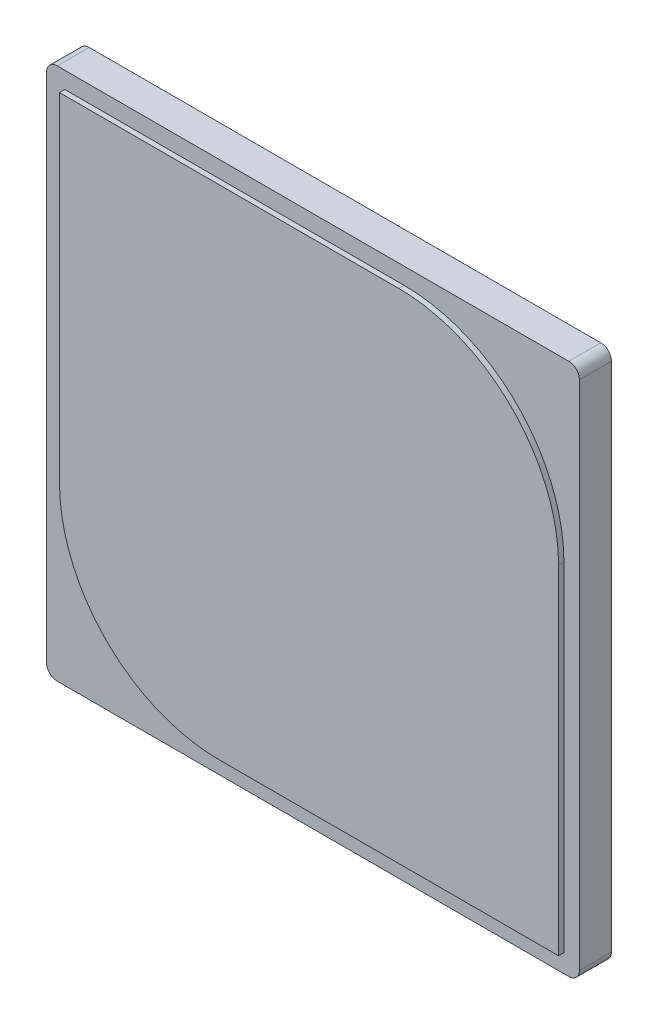
from build123d import *

# Parameters (mm, degrees)
SKETCH_1_W          = 10
SKETCH_1_H          = 10
EXTRUDE_1_DEPTH     = 0.7
SKETCH_2_W          = 10
SKETCH_2_H          = 10
CUT_EXTRUDE_1_DEPTH = 0.1
FILLET_1_R          = 0.2


with BuildPart() as part:
    # 草图1 → 凸台-拉伸1 (new body)
    with BuildSketch(Plane.XY):
        with Locations((-10.731707317, 12.731707317)):
            Rectangle(SKETCH_1_W, SKETCH_1_H)
    extrude(amount=EXTRUDE_1_DEPTH)

    # 草图2 → 切除-拉伸1 (cut)
    with BuildSketch(Plane.XY.offset(0.7)):
        with Locations((-10.731707317, 12.731707317)):
            Rectangle(SKETCH_2_W, SKETCH_2_H)
        with BuildLine():
            Line((-15.389589016, 17.419802303), (-9.02347014, 17.419802303))
            ThreePointArc((-9.02347014, 17.419802303), (-6.902149796, 16.541122647), (-6.02347014, 14.419802303))
            Line((-6.02347014, 14.419802303), (-6.02347014, 8.073825618))
            Line((-6.02347014, 8.073825618), (-12.389589016, 8.073825618))
            ThreePointArc((-12.389589016, 8.073825618), (-14.51090936, 8.952505274), (-15.389589016, 11.073825618))
            Line((-15.389589016, 11.073825618), (-15.389589016, 17.419802303))
        make_face(mode=Mode.SUBTRACT)
    extrude(amount=-CUT_EXTRUDE_1_DEPTH, mode=Mode.SUBTRACT)

    # 圆角1
    fillet_1_edges = [part.edges().sort_by_distance(p)[0] for p in [
        (-15.731707317, 17.731707317, 0.3),
        (-5.731707317, 17.731707317, 0.3),
        (-5.731707317, 7.731707317, 0.3),
        (-15.731707317, 7.731707317, 0.3),
    ]]
    fillet(fillet_1_edges, radius=FILLET_1_R)


solid = part.part
